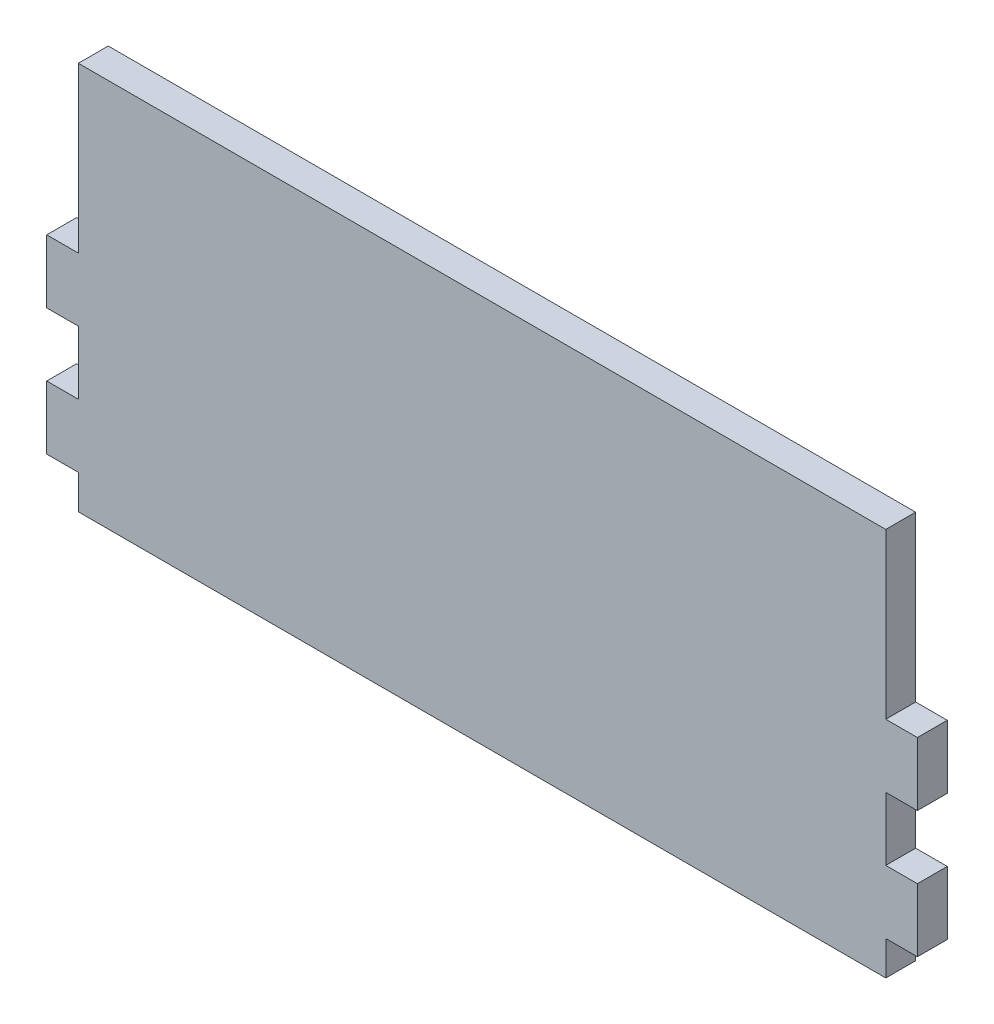
from build123d import *

# Parameters (mm, degrees)
BOSS_EXTRUDE1_DEPTH = 2.9972


with BuildPart() as part:
    # Sketch1 → Boss-Extrude1 (new body)
    with BuildSketch(Plane.XY):
        Polygon((0, 0), (0, 3.431921508), (-3.175, 3.431921508), (-3.175, 9.781921508), (0, 9.781921508), (0, 16.131921508), (-3.175, 16.131921508), (-3.175, 22.481921508), (0, 22.481921508), (0, 38.975223802), (81, 38.975223802), (81, 22.481921508), (84.175, 22.481921508), (84.175, 16.131921508), (81, 16.131921508), (81, 9.781921508), (84.175, 9.781921508), (84.175, 3.431921508), (81, 3.431921508), (81, 0), align=None)
    extrude(amount=BOSS_EXTRUDE1_DEPTH)


solid = part.part
